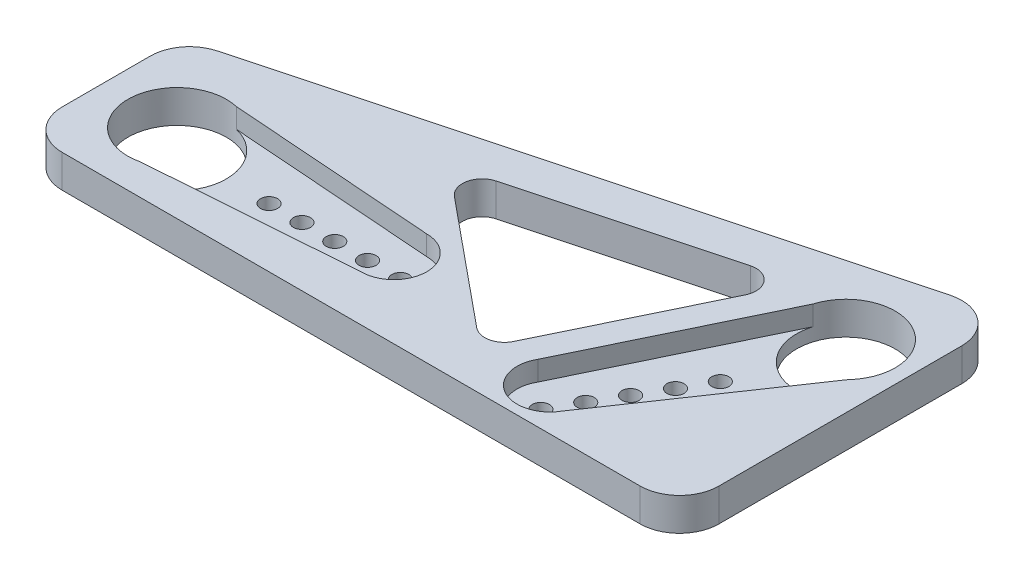
from build123d import *

# Parameters (mm, degrees)
SKETCH1_R           = 3.75
SKETCH1_R_2         = 0.65
BOSS_EXTRUDE1_DEPTH = 2.5
CUT_EXTRUDE1_START  = -1.5
SKETCH2_R           = 0.65
CUT_EXTRUDE1_DEPTH  = 1.5
FILLET1_R           = 3
CUT_EXTRUDE3_DEPTH  = 56.730615831
FILLET2_R           = 1.5


with BuildPart() as part:
    # Sketch1 → Boss-Extrude1 (new body)
    with BuildSketch(Plane(origin=(0, 0, 0), x_dir=(1, 0, 0), z_dir=(0, 1, 0))):
        Polygon((0, 0), (0, 12), (50, 25.397459622), (50, 0), align=None)
        with Locations(Location((5.75, 6, 0), (0, 0, 270))):
            Circle(SKETCH1_R, mode=Mode.SUBTRACT)
        with Locations(Location((22.75, 6, 0), (0, 0, 270))):
            Circle(SKETCH1_R_2, mode=Mode.SUBTRACT)
        with Locations(Location((45.166201183, 17.5, 0), (0, 0, 270))):
            Circle(SKETCH1_R, mode=Mode.SUBTRACT)
        with Locations(Location((36.666201183, 2.777568136, 0), (0, 0, 270))):
            Circle(SKETCH1_R_2, mode=Mode.SUBTRACT)
        with Locations(Location((37.916201183, 4.942631645, 0), (0, 0, 270))):
            Circle(SKETCH1_R_2, mode=Mode.SUBTRACT)
        with Locations(Location((39.166201183, 7.107695155, 0), (0, 0, 270))):
            Circle(SKETCH1_R_2, mode=Mode.SUBTRACT)
        with Locations(Location((40.416201183, 9.272758664, 0), (0, 0, 270))):
            Circle(SKETCH1_R_2, mode=Mode.SUBTRACT)
        with Locations(Location((41.666201183, 11.437822174, 0), (0, 0, 270))):
            Circle(SKETCH1_R_2, mode=Mode.SUBTRACT)
        with Locations(Location((20.25, 6, 0), (0, 0, 270))):
            Circle(SKETCH1_R_2, mode=Mode.SUBTRACT)
        with Locations(Location((17.75, 6, 0), (0, 0, 270))):
            Circle(SKETCH1_R_2, mode=Mode.SUBTRACT)
        with Locations(Location((15.25, 6, 0), (0, 0, 270))):
            Circle(SKETCH1_R_2, mode=Mode.SUBTRACT)
        with Locations(Location((12.75, 6, 0), (0, 0, 270))):
            Circle(SKETCH1_R_2, mode=Mode.SUBTRACT)
    extrude(amount=BOSS_EXTRUDE1_DEPTH)

    # Sketch2 → Cut-Extrude1 (cut)
    # profile 1 of 3: a face of its own
    with BuildSketch(Plane(origin=(0, 2.5, 0), x_dir=(1, 0, 0), z_dir=(0, 1, 0)).offset(CUT_EXTRUDE1_START)):
        with BuildLine():
            Line((22.25, 8.5), (6.610232527, 9.65))
            ThreePointArc((6.610232527, 9.65), (8.690099656, 8.32772722), (9.5, 6))
            ThreePointArc((9.5, 6), (8.690099656, 3.67227278), (6.610232527, 2.35))
            Line((6.610232527, 2.35), (22.25, 3.5))
            ThreePointArc((22.25, 3.5), (24.75, 6), (22.25, 8.5))
        make_face()
        with Locations(Location((12.75, 6, 0), (0, 0, 270))):
            Circle(SKETCH2_R, mode=Mode.SUBTRACT)
        with Locations(Location((15.25, 6, 0), (0, 0, 270))):
            Circle(SKETCH2_R, mode=Mode.SUBTRACT)
        with Locations(Location((17.75, 6, 0), (0, 0, 270))):
            Circle(SKETCH2_R, mode=Mode.SUBTRACT)
        with Locations(Location((20.25, 6, 0), (0, 0, 270))):
            Circle(SKETCH2_R, mode=Mode.SUBTRACT)
        with Locations(Location((22.75, 6, 0), (0, 0, 270))):
            Circle(SKETCH2_R, mode=Mode.SUBTRACT)
    # profile 2 of 3: a face of its own
    with BuildSketch(Plane(origin=(0, 2.5, 0), x_dir=(1, 0, 0), z_dir=(0, 1, 0)).offset(CUT_EXTRUDE1_START)):
        with BuildLine():
            ThreePointArc((47.897077643, 14.930016779), (45.712022261, 13.789935398), (43.291201183, 14.252404736))
            Line((43.291201183, 14.252404736), (41.991201183, 12.000738686))
            ThreePointArc((41.991201183, 12.000738686), (42.229117695, 11.762822174), (42.316201183, 11.437822174))
            ThreePointArc((42.316201183, 11.437822174), (41.991201183, 10.874905661), (41.341201183, 10.874905661))
            Line((41.341201183, 10.874905661), (40.741201183, 9.835675177))
            ThreePointArc((40.741201183, 9.835675177), (40.979117695, 9.597758664), (41.066201183, 9.272758664))
            ThreePointArc((41.066201183, 9.272758664), (40.741201183, 8.709842152), (40.091201183, 8.709842152))
            Line((40.091201183, 8.709842152), (39.491201183, 7.670611667))
            ThreePointArc((39.491201183, 7.670611667), (39.729117695, 7.432695155), (39.816201183, 7.107695155))
            ThreePointArc((39.816201183, 7.107695155), (39.491201183, 6.544778642), (38.841201183, 6.544778642))
            Line((38.841201183, 6.544778642), (38.241201183, 5.505548158))
            ThreePointArc((38.241201183, 5.505548158), (38.479117695, 5.267631645), (38.566201183, 4.942631645))
            ThreePointArc((38.566201183, 4.942631645), (38.241201183, 4.379715133), (37.591201183, 4.379715133))
            Line((37.591201183, 4.379715133), (36.991201183, 3.340484648))
            ThreePointArc((36.991201183, 3.340484648), (37.229117695, 3.102568136), (37.316201183, 2.777568136))
            ThreePointArc((37.316201183, 2.777568136), (36.991201183, 2.214651623), (36.341201183, 2.214651623))
            Line((36.341201183, 2.214651623), (35.666201183, 1.045517328))
            ThreePointArc((35.666201183, 1.045517328), (37.563248796, 0.795766272), (39.081264692, 1.960580838))
            Line((39.081264692, 1.960580838), (47.897077643, 14.930016779))
        make_face()
    # profile 3 of 3: a face of its own
    with BuildSketch(Plane(origin=(0, 2.5, 0), x_dir=(1, 0, 0), z_dir=(0, 1, 0)).offset(CUT_EXTRUDE1_START)):
        with BuildLine():
            Line((41.991201183, 12.000738686), (43.291201183, 14.252404736))
            ThreePointArc((43.291201183, 14.252404736), (41.680280449, 16.117662618), (41.575092196, 18.580016779))
            Line((41.575092196, 18.580016779), (34.751137673, 4.460580838))
            ThreePointArc((34.751137673, 4.460580838), (34.501386617, 2.563533225), (35.666201183, 1.045517328))
            Line((35.666201183, 1.045517328), (36.341201183, 2.214651623))
            ThreePointArc((36.341201183, 2.214651623), (36.10328467, 3.102568136), (36.991201183, 3.340484648))
            Line((36.991201183, 3.340484648), (37.591201183, 4.379715133))
            ThreePointArc((37.591201183, 4.379715133), (37.35328467, 5.267631645), (38.241201183, 5.505548158))
            Line((38.241201183, 5.505548158), (38.841201183, 6.544778642))
            ThreePointArc((38.841201183, 6.544778642), (38.60328467, 7.432695155), (39.491201183, 7.670611667))
            Line((39.491201183, 7.670611667), (40.091201183, 8.709842152))
            ThreePointArc((40.091201183, 8.709842152), (39.85328467, 9.597758664), (40.741201183, 9.835675177))
            Line((40.741201183, 9.835675177), (41.341201183, 10.874905661))
            ThreePointArc((41.341201183, 10.874905661), (41.10328467, 11.762822174), (41.991201183, 12.000738686))
        make_face()
    extrude(amount=CUT_EXTRUDE1_DEPTH, mode=Mode.SUBTRACT)

    # Fillet1
    fillet1_edges = [part.edges().sort_by_distance(p)[0] for p in [
        (50, 1.25, 0),
        (0, 1.25, 0),
        (0, 1.25, -12),
        (50, 1.25, -25.397459622),
    ]]
    fillet(fillet1_edges, radius=FILLET1_R)

    # Sketch3 → Cut-Extrude3 (cut, through all)
    with BuildSketch(Plane(origin=(0, 2.5, 0), x_dir=(1, 0, 0), z_dir=(0, 1, 0))):
        Polygon((18.580286951, 13.872744342), (39.830655129, 19.566763335), (31.823901882, 3), align=None)
    extrude(amount=-CUT_EXTRUDE3_DEPTH, mode=Mode.SUBTRACT)

    # Fillet2
    fillet2_edges = [part.edges().sort_by_distance(p)[0] for p in [
        (31.823901882, 1.25, -3),
        (18.580286951, 1.25, -13.872744342),
        (39.830655129, 1.25, -19.566763335),
    ]]
    fillet(fillet2_edges, radius=FILLET2_R)


solid = part.part
